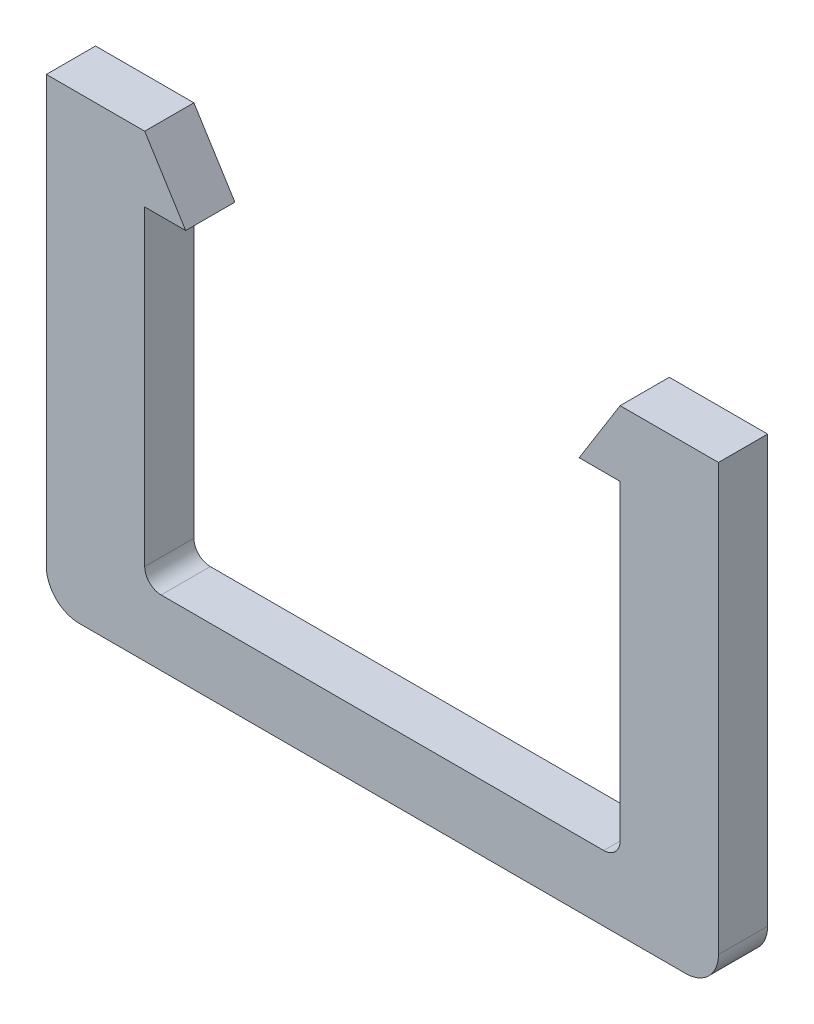
from build123d import *

# Parameters (mm, degrees)
BOSS_EXTRUDE1_DEPTH = 1.5


with BuildPart() as part:
    # Sketch1 → Boss-Extrude1 (new, symmetric)
    with BuildSketch(Plane.XY):
        with BuildLine():
            Line((-13.5, 4), (13.5, 4))
            ThreePointArc((13.5, 4), (14.207106781, 4.292893219), (14.5, 5))
            Line((14.5, 5), (14.5, 24))
            Line((14.5, 24), (12, 24))
            Line((12, 24), (14.5, 28))
            Line((14.5, 28), (20.5, 28))
            Line((20.5, 28), (20.5, 2))
            ThreePointArc((20.5, 2), (19.914213562, 0.585786438), (18.5, 0))
            Line((18.5, 0), (-18.5, 0))
            ThreePointArc((-18.5, 0), (-19.914213562, 0.585786438), (-20.5, 2))
            Line((-20.5, 2), (-20.5, 28))
            Line((-20.5, 28), (-14.5, 28))
            Line((-14.5, 28), (-12, 24))
            Line((-12, 24), (-14.5, 24))
            Line((-14.5, 24), (-14.5, 5))
            ThreePointArc((-14.5, 5), (-14.207106781, 4.292893219), (-13.5, 4))
        make_face()
    extrude(amount=BOSS_EXTRUDE1_DEPTH, both=True)


solid = part.part
